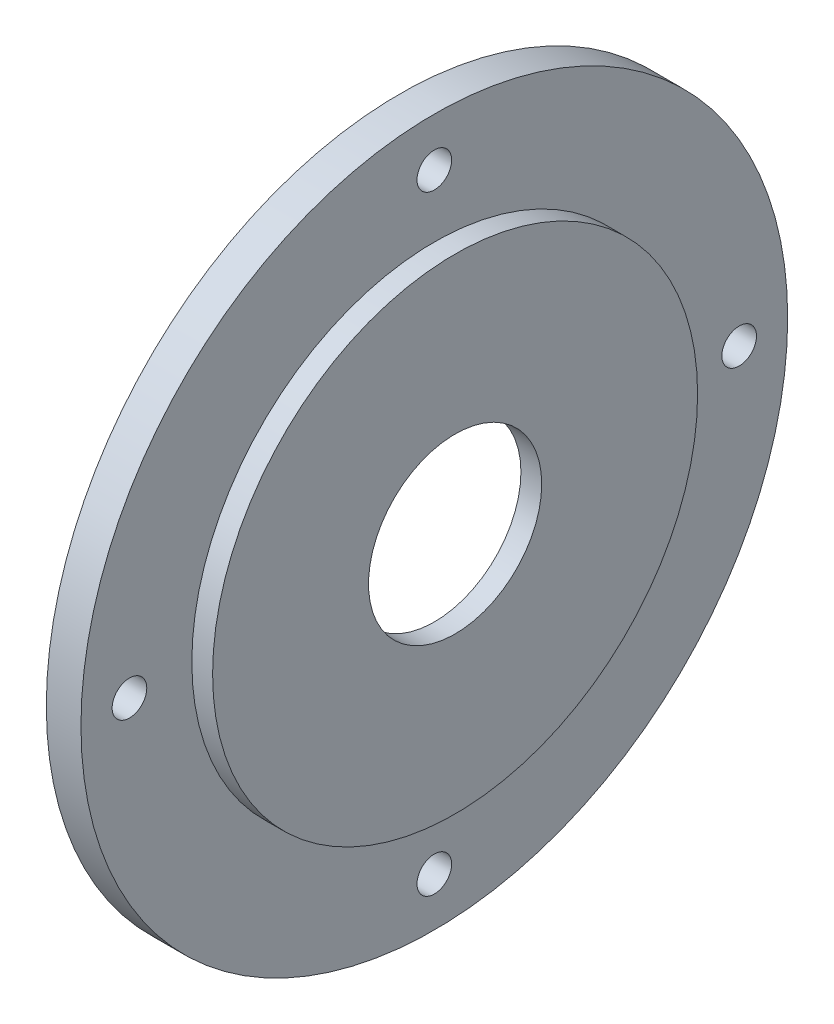
from build123d import *

# Parameters (mm, degrees)
SKETCH_1_R          = 51
SKETCH_1_R_2        = 27
EXTRUDE_1_DEPTH     = 5
SKETCH_2_R          = 35
EXTRUDE_2_DEPTH     = 3
SKETCH_3_R          = 2.5
CUT_EXTRUDE_1_DEPTH = 5
SKETCH_4_R          = 12.5
CUT_EXTRUDE_2_DEPTH = 8


with BuildPart() as part:
    # 草图1 → 凸台-拉伸1 (new body)
    with BuildSketch(Plane(origin=(0, 0, 0), x_dir=(0, 0, -1), z_dir=(1, 0, 0))):
        Circle(SKETCH_1_R)
        Circle(SKETCH_1_R_2, mode=Mode.SUBTRACT)
    extrude(amount=EXTRUDE_1_DEPTH)

    # 草图2 → 凸台-拉伸2 (add)
    with BuildSketch(Plane(origin=(5, 0, 0), x_dir=(0, 0, -1), z_dir=(1, 0, 0))):
        Circle(SKETCH_2_R)
    extrude(amount=EXTRUDE_2_DEPTH)

    # 草图3 → 切除-拉伸1 (cut)
    with BuildSketch(Plane(origin=(5, 0, 0), x_dir=(0, 0, -1), z_dir=(1, 0, 0))):
        with Locations((0, 44)):
            Circle(SKETCH_3_R)
        with Locations((44, 0)):
            Circle(SKETCH_3_R)
        with Locations((0, -44)):
            Circle(SKETCH_3_R)
        with Locations((-44, 0)):
            Circle(SKETCH_3_R)
    extrude(amount=-CUT_EXTRUDE_1_DEPTH, mode=Mode.SUBTRACT)

    # 草图4 → 切除-拉伸2 (cut)
    with BuildSketch(Plane(origin=(8, 0, 0), x_dir=(0, 0, -1), z_dir=(1, 0, 0))):
        Circle(SKETCH_4_R)
    extrude(amount=-CUT_EXTRUDE_2_DEPTH, mode=Mode.SUBTRACT)


solid = part.part
